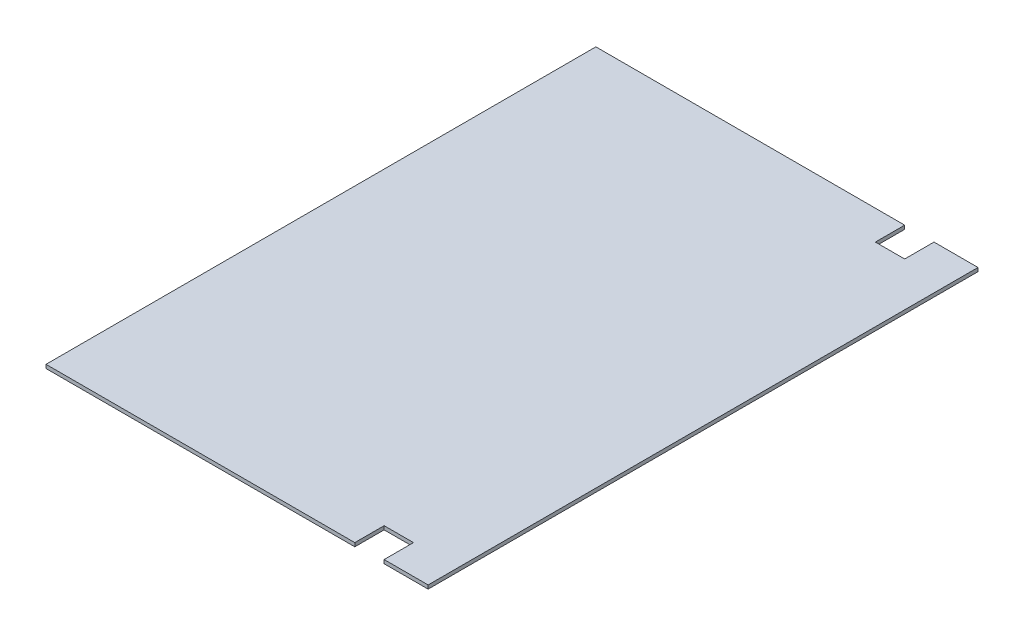
from build123d import *

# Parameters (mm, degrees)
SKETCH1_W           = 330.962
SKETCH1_H           = 476.25
BOSS_EXTRUDE1_DEPTH = 3.175
SKETCH2_W           = 25.4
SKETCH2_H           = 25.4
CUT_EXTRUDE1_DEPTH  = 580.965506361


with BuildPart() as part:
    # Sketch1 → Boss-Extrude1 (new body)
    with BuildSketch(Plane(origin=(0, 0, 0), x_dir=(1, 0, 0), z_dir=(0, 1, 0))):
        with Locations((165.481, 238.125)):
            Rectangle(SKETCH1_W, SKETCH1_H)
    extrude(amount=BOSS_EXTRUDE1_DEPTH)

    # Sketch2 → Cut-Extrude1 (cut, through all)
    with BuildSketch(Plane(origin=(0, 3.175, 0), x_dir=(1, 0, 0), z_dir=(0, 1, 0))):
        with Locations((280.162, 12.7)):
            Rectangle(SKETCH2_W, SKETCH2_H)
        with Locations((280.162, 463.55)):
            Rectangle(SKETCH2_W, SKETCH2_H)
    extrude(amount=-CUT_EXTRUDE1_DEPTH, mode=Mode.SUBTRACT)


solid = part.part
